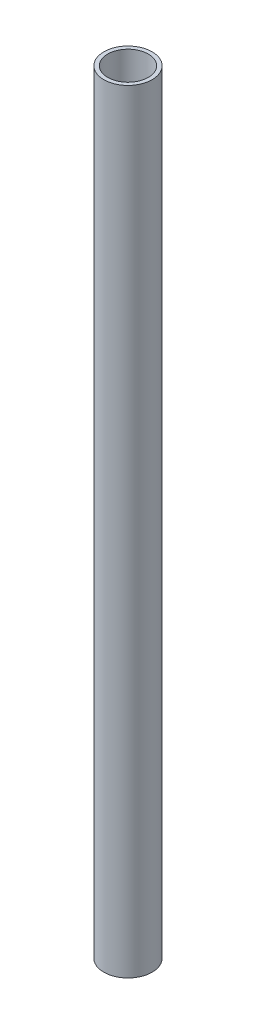
from build123d import *

# Parameters (mm, degrees)
CROQUIS1_R              = 12.5
CROQUIS1_R_2            = 10.5
SALIENTE_EXTRUIR1_DEPTH = 400


with BuildPart() as part:
    # Croquis1 → Saliente-Extruir1 (new body)
    with BuildSketch(Plane(origin=(0, 0, 0), x_dir=(1, 0, 0), z_dir=(0, 1, 0))):
        with Locations(Location((0, 0, 0), (0, 0, 270))):
            Circle(CROQUIS1_R)
        with Locations(Location((0, 0, 0), (0, 0, 270))):
            Circle(CROQUIS1_R_2, mode=Mode.SUBTRACT)
    extrude(amount=SALIENTE_EXTRUIR1_DEPTH)


solid = part.part
